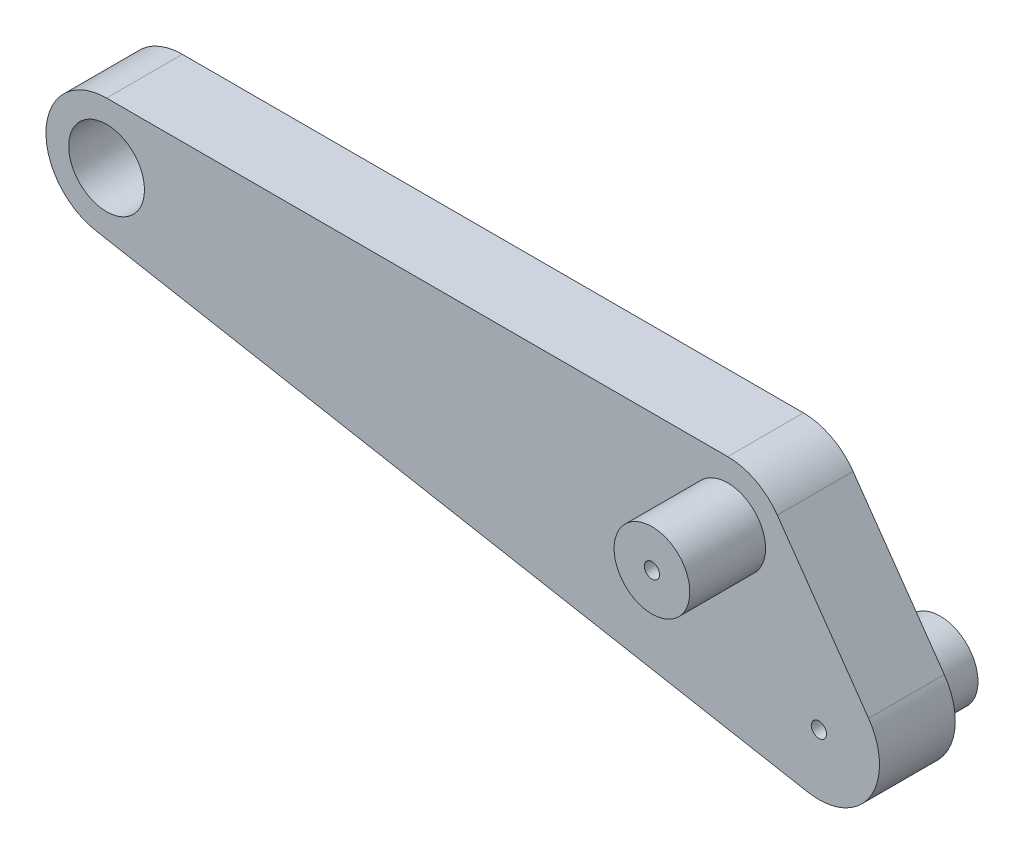
from build123d import *

# Parameters (mm, degrees)
SKETCH2_R           = 2.5
BOSS_EXTRUDE1_DEPTH = 5
BOSS_EXTRUDE2_START = -8
SKETCH3_R           = 2.5
SKETCH3_R_2         = 0.5
BOSS_EXTRUDE2_DEPTH = 8
SKETCH4_R           = 2.5
SKETCH4_R_2         = 0.5
BOSS_EXTRUDE3_DEPTH = 10


with BuildPart() as part:
    # Sketch2 → Boss-Extrude1 (new body)
    with BuildSketch(Plane.XY):
        with BuildLine():
            Line((-41, 4), (0, 4))
            ThreePointArc((0, 4), (1.846994453, 3.548043333), (3.276608177, 2.294305745))
            Line((3.276608177, 2.294305745), (9.299160759, -6.30679072))
            ThreePointArc((9.299160759, -6.30679072), (9.389243762, -10.761047968), (5.302836395, -12.53581483))
            Line((5.302836395, -12.53581483), (-41.719716186, -3.934718365))
            ThreePointArc((-41.719716186, -3.934718365), (-44.98364616, 0.361335399), (-41, 4))
        make_face()
        with Locations((-41, 0)):
            Circle(SKETCH2_R, mode=Mode.SUBTRACT)
        Circle(SKETCH2_R, mode=Mode.SUBTRACT)
        with Locations((6.022552582, -8.601096465)):
            Circle(SKETCH2_R, mode=Mode.SUBTRACT)
    extrude(amount=BOSS_EXTRUDE1_DEPTH)

    # Sketch3 → Boss-Extrude2 (add)
    with BuildSketch(Plane.XY.offset(5).offset(BOSS_EXTRUDE2_START)):
        with Locations((6.022552582, -8.601096465)):
            Circle(SKETCH3_R)
        with Locations((6.022552582, -8.601096465)):
            Circle(SKETCH3_R_2, mode=Mode.SUBTRACT)
    extrude(amount=BOSS_EXTRUDE2_DEPTH)

    # Sketch4 → Boss-Extrude3 (add)
    with BuildSketch(Plane(origin=(0, 0, 0), x_dir=(-1, 0, 0), z_dir=(0, 0, -1))):
        Circle(SKETCH4_R)
        Circle(SKETCH4_R_2, mode=Mode.SUBTRACT)
    extrude(amount=-BOSS_EXTRUDE3_DEPTH)


solid = part.part
